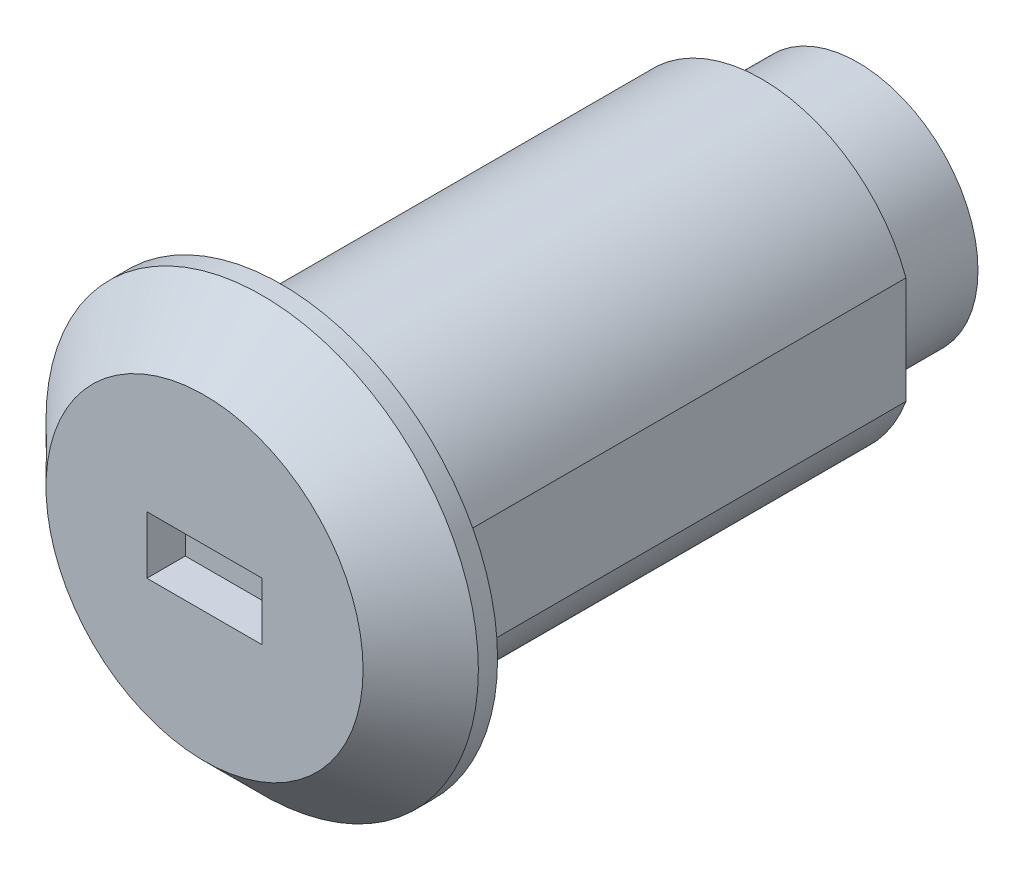
from build123d import *

# Parameters (mm, degrees)
SKETCH_1_R          = 11.25
EXTRUDE_1_DEPTH     = 4
CHAMFER_1_SIZE      = 3
SKETCH_2_W          = 6
SKETCH_2_H          = 3
CUT_EXTRUDE_1_DEPTH = 2
EXTRUDE_2_DEPTH     = 25
SKETCH_4_R          = 6.25
EXTRUDE_3_DEPTH     = 5


with BuildPart() as part:
    # 草图1 → 拉伸1 (new body)
    with BuildSketch(Plane.XY):
        Circle(SKETCH_1_R)
    extrude(amount=EXTRUDE_1_DEPTH)

    # 倒角1
    chamfer_1_edges = [part.edges().sort_by_distance(p)[0] for p in [
        (-11.25, 0, 4),
    ]]
    chamfer(chamfer_1_edges, length=CHAMFER_1_SIZE)

    # 草图2 → 切除-拉伸1 (cut)
    with BuildSketch(Plane.XY.offset(4)):
        Rectangle(SKETCH_2_W, SKETCH_2_H)
    extrude(amount=-CUT_EXTRUDE_1_DEPTH, mode=Mode.SUBTRACT)

    # 草图3 → 拉伸2 (add)
    with BuildSketch(Plane(origin=(0, 0, 0), x_dir=(-1, 0, 0), z_dir=(0, 0, -1))):
        with BuildLine():
            Line((-7.5, 2.783882181), (-7.5, -2.783882181))
            ThreePointArc((-7.5, -2.783882181), (0, -8), (7.5, -2.783882181))
            Line((7.5, -2.783882181), (7.5, 2.783882181))
            ThreePointArc((7.5, 2.783882181), (0, 8), (-7.5, 2.783882181))
        make_face()
    extrude(amount=EXTRUDE_2_DEPTH)

    # 草图4 → 拉伸3 (add)
    with BuildSketch(Plane(origin=(0, 0, -25), x_dir=(-1, 0, 0), z_dir=(0, 0, -1))):
        Circle(SKETCH_4_R)
    extrude(amount=EXTRUDE_3_DEPTH)


solid = part.part
